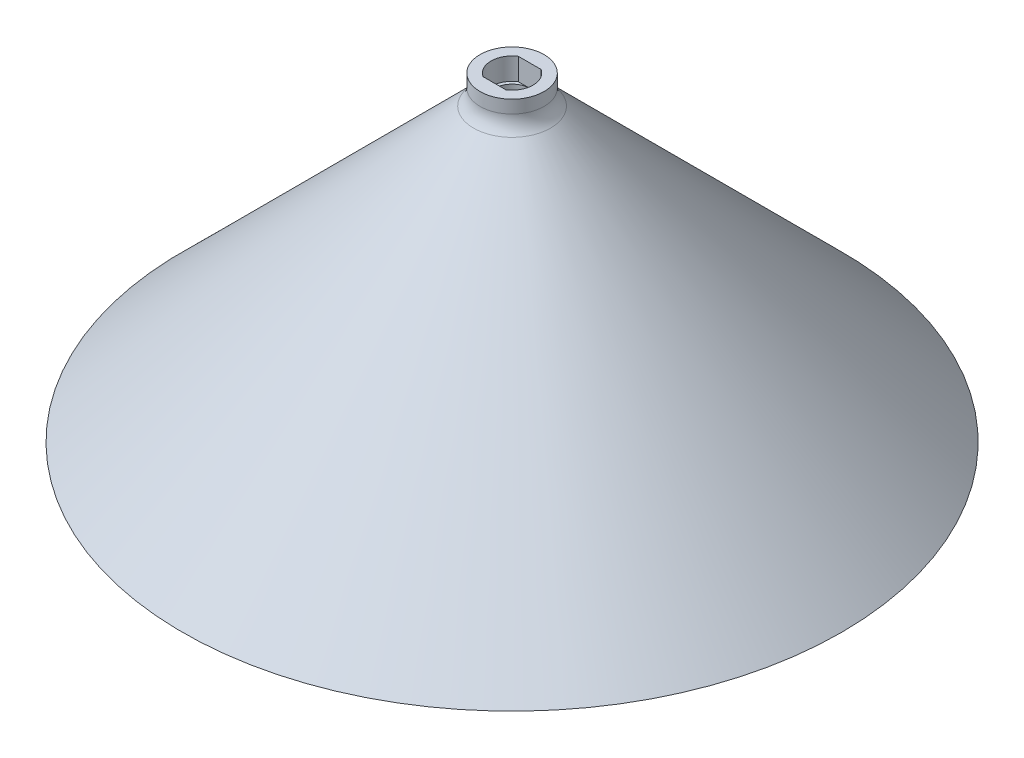
from build123d import *

# Parameters (mm, degrees)
SKETCH1_R                                   = 14.525
KEYED_PORTION_ADAPTER_DEPTH                 = 10
STOPPER_START                               = 10
SKETCH2_R                                   = 14.525
SKETCH2_R_2                                 = 8.001087489
STOPPER_ON_THREADED_PORTION_OF_PISTON_DEPTH = 10
PISTON_HOLDER_TO_CONICAL_BASE_ADAPTER_R     = 10


with BuildPart() as part:
    # Sketch1 → Keyed portion adapter (new body)
    with BuildSketch(Plane(origin=(0, 0, 0), x_dir=(1, 0, 0), z_dir=(0, 1, 0))):
        with Locations(Location((0, 0, 0), (0, 0, 270))):
            Circle(SKETCH1_R)
        with BuildLine():
            Line((-5.168, 8.001087489), (5.168, 8.001087489))
            ThreePointArc((5.168, 8.001087489), (9.525, 0), (5.168, -8.001087489))
            Line((5.168, -8.001087489), (-5.168, -8.001087489))
            ThreePointArc((-5.168, -8.001087489), (-9.525, 0), (-5.168, 8.001087489))
        make_face(mode=Mode.SUBTRACT)
    extrude(amount=KEYED_PORTION_ADAPTER_DEPTH)

    # Sketch2 → Stopper (on threaded portion of piston) (add)
    with BuildSketch(Plane.XZ.offset(STOPPER_START)):
        with Locations(Location((0, 0, 0), (0, 0, 270))):
            Circle(SKETCH2_R)
        with Locations(Location((0, 0, 0), (0, 0, 270))):
            Circle(SKETCH2_R_2, mode=Mode.SUBTRACT)
    extrude(amount=-STOPPER_ON_THREADED_PORTION_OF_PISTON_DEPTH)

    # Sketch3 → Conical base (revolve)
    with BuildSketch(Plane.XY):
        Polygon((8.001087489, -10), (8.001087489, 0), (14.525, 0), (149.525, -135), (133.001087489, -135), align=None)
    revolve(axis=Axis((0, 0, 0), (0, -1, 0)))

    # Piston holder to conical base adapter
    piston_holder_to_conical_base_adapter_edges = [part.edges().sort_by_distance(p)[0] for p in [
        (-10.270725997, 0, -10.270725997),
    ]]
    fillet(piston_holder_to_conical_base_adapter_edges, radius=PISTON_HOLDER_TO_CONICAL_BASE_ADAPTER_R)


solid = part.part
